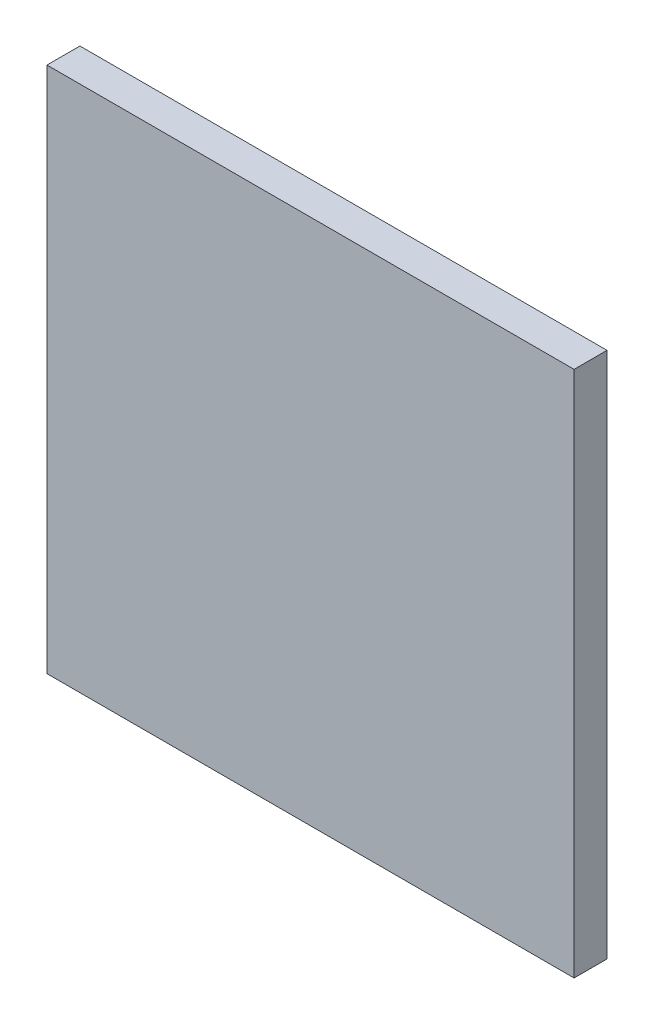
from build123d import *

# Parameters (mm, degrees)
SKETCH_1_W      = 800
SKETCH_1_H      = 800
EXTRUDE_1_DEPTH = 25


with BuildPart() as part:
    # Эскиз1 → Бобышка-Вытянуть1 (new, symmetric)
    with BuildSketch(Plane.XY):
        Rectangle(SKETCH_1_W, SKETCH_1_H)
    extrude(amount=EXTRUDE_1_DEPTH, both=True)


solid = part.part
